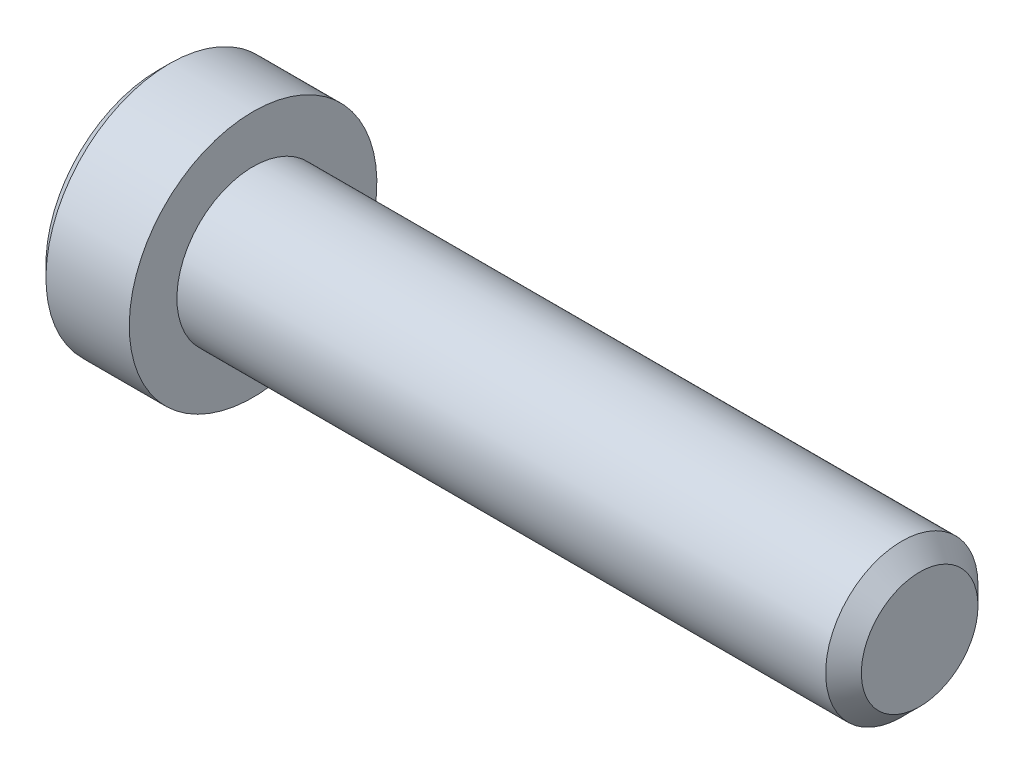
from build123d import *

# Parameters (mm, degrees)
SKETCH2_R           = 4
BOSS_EXTRUDE1_DEPTH = 22
CHAMFER1_SIZE       = 0.9375
CUT_EXTRUDE1_DEPTH  = 3.95


with BuildPart() as part:
    # Sketch2 → Boss-Extrude1 (new body)
    with BuildSketch(Plane(origin=(17.5, 0, 0), x_dir=(0, 0, -1), z_dir=(1, 0, 0))):
        Circle(SKETCH2_R)
    extrude(amount=-BOSS_EXTRUDE1_DEPTH)

    # Chamfer1
    chamfer1_edges = [part.edges().sort_by_distance(p)[0] for p in [
        (17.5, 0, 4),
    ]]
    chamfer(chamfer1_edges, length=CHAMFER1_SIZE)

    # Sketch10 → Revolve2 (revolve)
    with BuildSketch(Plane.XY, mode=Mode.PRIVATE) as revolve2_sk:
        Polygon((-2.190598923, 0), (-4.5, 4), (-17.5, 4), (-17.5, 0), align=None)
    revolve(revolve2_sk.sketch.rotate(Axis((-17.5, 0, 0), (1, 0, 0)), 270), axis=Axis((-17.5, 0, 0), (1, 0, 0)))

    # Sketch6 → Revolve1 (revolve)
    with BuildSketch(Plane.XY):
        Polygon((-21.875, 6.5), (-22.5, 5.875), (-22.5, 0), (-17.5, 0), (-17.5, 6.5), align=None)
    revolve(axis=Axis((-17.5, 0, 0), (-1, 0, 0)))

    # Sketch4 → Cut-Extrude1 (cut)
    with BuildSketch(Plane(origin=(-22.5, 0, 0), x_dir=(0, 0, -1), z_dir=(1, 0, 0))):
        Polygon((0, 2.886751346), (-2.5, 1.443375673), (-2.5, -1.443375673), (0, -2.886751346), (2.5, -1.443375673), (2.5, 1.443375673), align=None)
    extrude(amount=CUT_EXTRUDE1_DEPTH, mode=Mode.SUBTRACT)

    # Cut-Extrude2 cone 1 section (through the dimple's axis) → Cut-Extrude2 (revolve, cut)
    with BuildSketch(Plane(origin=(-22.5, 0, 0), x_dir=(0, 0, 1), z_dir=(0, 1, 0))):
        Polygon((0, 0), (2.886751346, 0), (0, 2.886751346), align=None)
    revolve(axis=Axis((-22.5, 0, 0), (1, 0, 0)), mode=Mode.SUBTRACT)


solid = part.part
